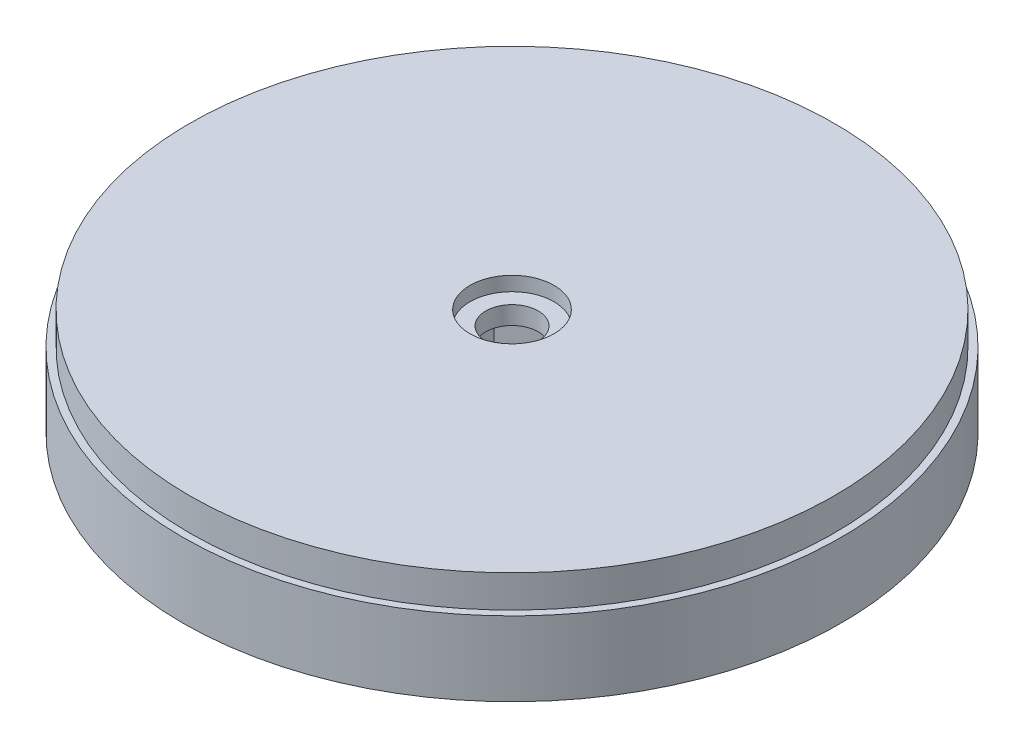
from build123d import *

# Parameters (mm, degrees)
SKETCH1_R           = 51
BOSS_EXTRUDE1_DEPTH = 11.5
SKETCH2_R           = 49.9
SKETCH2_R_2         = 4.05
BOSS_EXTRUDE2_DEPTH = 5
SKETCH3_R           = 8
CUT_EXTRUDE1_DEPTH  = 7
SKETCH4_R           = 6.5
CUT_EXTRUDE2_DEPTH  = 2.2


with BuildPart() as part:
    # Sketch1 → Boss-Extrude1 (new body)
    with BuildSketch(Plane(origin=(0, 0, 0), x_dir=(1, 0, 0), z_dir=(0, 1, 0))):
        with Locations(Location((0, 0, 0), (0, 0, 270))):
            Circle(SKETCH1_R)
        Polygon((0, 7.505553499), (-6.5, 3.75277675), (-6.5, -3.75277675), (0, -7.505553499), (6.5, -3.75277675), (6.5, 3.75277675), align=None, mode=Mode.SUBTRACT)
    extrude(amount=BOSS_EXTRUDE1_DEPTH)

    # Sketch2 → Boss-Extrude2 (add)
    with BuildSketch(Plane(origin=(0, 11.5, 0), x_dir=(1, 0, 0), z_dir=(0, 1, 0))):
        with Locations(Location((0, 0, 0), (0, 0, 270))):
            Circle(SKETCH2_R)
        with Locations(Location((0, 0, 0), (0, 0, 270))):
            Circle(SKETCH2_R_2, mode=Mode.SUBTRACT)
    extrude(amount=BOSS_EXTRUDE2_DEPTH)

    # Sketch3 → Cut-Extrude1 (cut)
    with BuildSketch(Plane.XZ):
        with Locations(Location((0, 0, 0), (0, 0, 270))):
            Circle(SKETCH3_R)
    extrude(amount=-CUT_EXTRUDE1_DEPTH, mode=Mode.SUBTRACT)

    # Sketch4 → Cut-Extrude2 (cut)
    with BuildSketch(Plane(origin=(0, 16.5, 0), x_dir=(1, 0, 0), z_dir=(0, 1, 0))):
        with Locations(Location((0, 0, 0), (0, 0, 270))):
            Circle(SKETCH4_R)
    extrude(amount=-CUT_EXTRUDE2_DEPTH, mode=Mode.SUBTRACT)


solid = part.part
